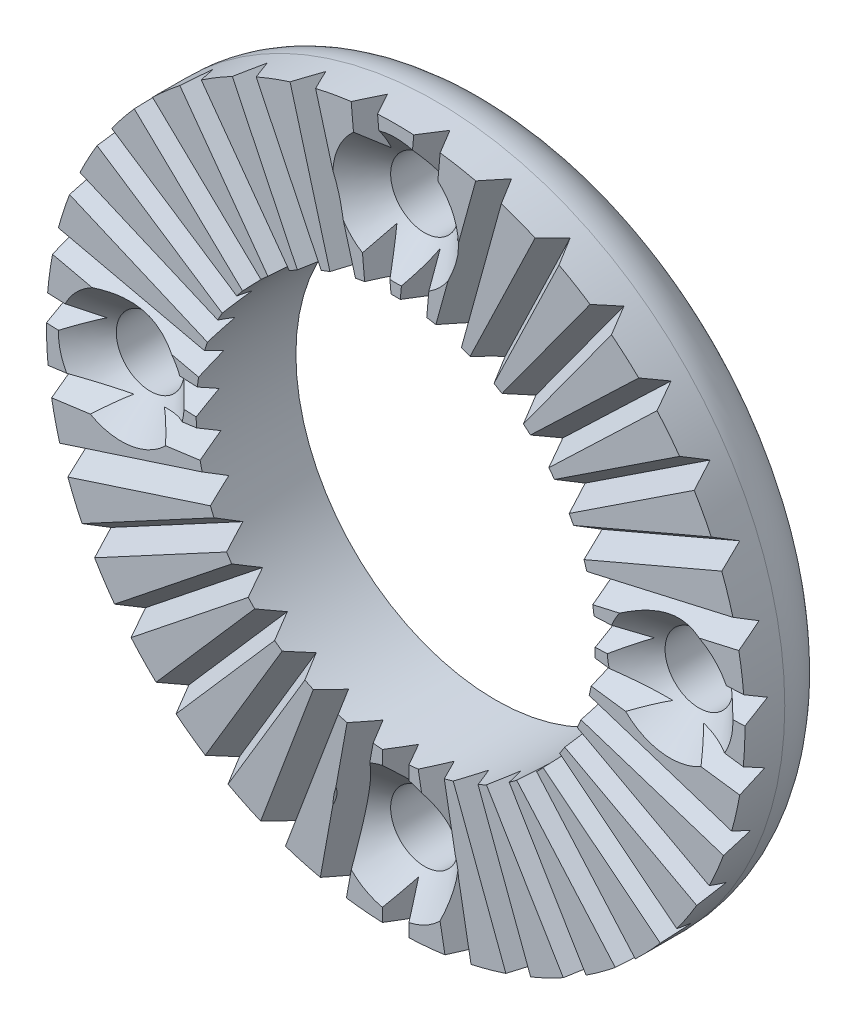
from build123d import *

# Parameters (mm, degrees)
ESBO_O1_R                = 17.5
RESSALTO_EXTRUS_O1_DEPTH = 5
FILETE1_R                = 3
CORTE_EXTRUS_O1_DEPTH    = 26.248762346
PADR_OCIRCULAR1_COUNT    = 35
ESBO_O3_R                = 10
CORTE_EXTRUS_O2_DEPTH    = 26.248762346
PADR_OCIRCULAR2_COUNT    = 4


with BuildPart() as part:
    # Esboço1 → Ressalto-extrusão1 (new body)
    with BuildSketch(Plane.XY):
        Circle(ESBO_O1_R)
    extrude(amount=RESSALTO_EXTRUS_O1_DEPTH)

    # Filete1
    filete1_edges = [part.edges().sort_by_distance(p)[0] for p in [
        (-17.5, 0, 0),
    ]]
    fillet(filete1_edges, radius=FILETE1_R)

    # Esboço2 → Corte-extrusão1 (cut, through all)
    with BuildSketch(Plane(origin=(0, 0, 0), x_dir=(1, 0, 0), z_dir=(0, 1, 0))):
        Polygon((-0.995929214, -5.575), (0.995929214, -5.575), (0, -3.85), align=None)
    corte_extrus_o1 = extrude(amount=-CORTE_EXTRUS_O1_DEPTH, mode=Mode.SUBTRACT)

    # PadrãoCircular1: Corte-extrusão1 ×35 about axis
    padr_ocircular1_axis = Axis((0, 0, 0), (0, 0, 1))
    for i in range(1, PADR_OCIRCULAR1_COUNT):
        add(corte_extrus_o1.rotate(padr_ocircular1_axis, i * 360 / PADR_OCIRCULAR1_COUNT), mode=Mode.SUBTRACT)

    # Esboço3 → Corte-extrusão2 (cut, through all)
    with BuildSketch(Plane(origin=(0, 0, 0), x_dir=(-1, 0, 0), z_dir=(0, 0, -1))):
        Circle(ESBO_O3_R)
    extrude(amount=-CORTE_EXTRUS_O2_DEPTH, mode=Mode.SUBTRACT)

    # Esboço7 → Escareado para parafuso com cabeça escareada elevada de M31 (revolve, cut)
    with BuildSketch(Plane(origin=(0, 13.75, 5), x_dir=(0, -1, 0), z_dir=(1, 0, 0))):
        Polygon((0, 0), (0, 73.771463052), (1.7, 72.75), (1.7, 1.45), (3.15, 0), align=None)
    escareado_para_parafuso_com_cabe_a_escar = revolve(axis=Axis((0, 13.75, 11.35), (0, 0, -1)), mode=Mode.SUBTRACT)

    # PadrãoCircular2: Escareado para parafuso com cabeça escareada elevada de M31 ×4 about axis
    padr_ocircular2_axis = Axis((0, 0, 0), (0, 0, 1))
    for i in range(1, PADR_OCIRCULAR2_COUNT):
        add(escareado_para_parafuso_com_cabe_a_escar.rotate(padr_ocircular2_axis, i * 360 / PADR_OCIRCULAR2_COUNT), mode=Mode.SUBTRACT)


solid = part.part
